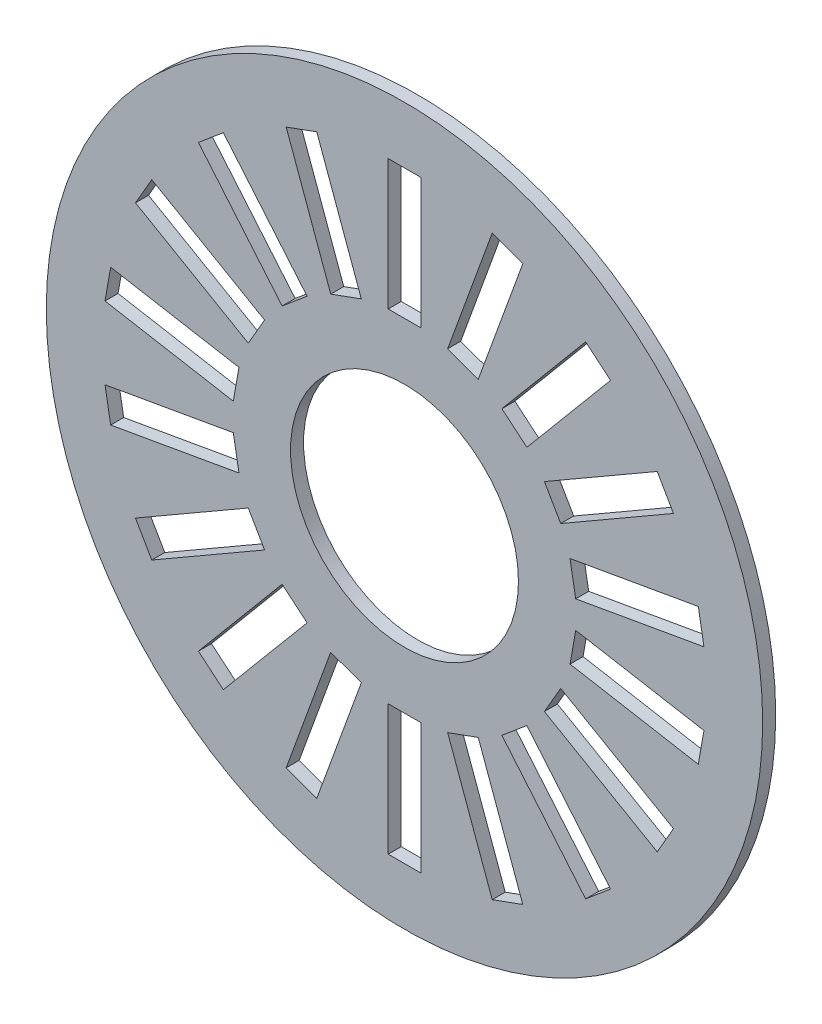
from build123d import *

# Parameters (mm, degrees)
ESQUISSE1_R                  = 11
ESQUISSE1_R_2                = 3.5
BOSS_EXTRU_1_DEPTH           = 0.4
ESQUISSE2_W                  = 1
ESQUISSE2_H                  = 4
ENL_V_MAT_EXTRU_1_DEPTH      = 16.561490931
R_P_TITION_CIRCULAIRE1_COUNT = 18


with BuildPart() as part:
    # Esquisse1 → Boss.-Extru.1 (new body)
    with BuildSketch(Plane.XY):
        Circle(ESQUISSE1_R)
        Circle(ESQUISSE1_R_2, mode=Mode.SUBTRACT)
    extrude(amount=BOSS_EXTRU_1_DEPTH)

    # Esquisse2 → Enlèv. mat.-Extru.1 (cut, symmetric)
    with BuildSketch(Plane.XY.offset(0.4)):
        with Locations((0, 7.25)):
            Rectangle(ESQUISSE2_W, ESQUISSE2_H)
    enl_v_mat_extru_1 = extrude(amount=ENL_V_MAT_EXTRU_1_DEPTH, both=True, mode=Mode.SUBTRACT)

    # Répétition circulaire1: Enlèv. mat.-Extru.1 ×18 about axis
    r_p_tition_circulaire1_axis = Axis((0, 0, 0), (0, 0, 1))
    for i in range(1, R_P_TITION_CIRCULAIRE1_COUNT):
        add(enl_v_mat_extru_1.rotate(r_p_tition_circulaire1_axis, i * 360 / R_P_TITION_CIRCULAIRE1_COUNT), mode=Mode.SUBTRACT)


solid = part.part
